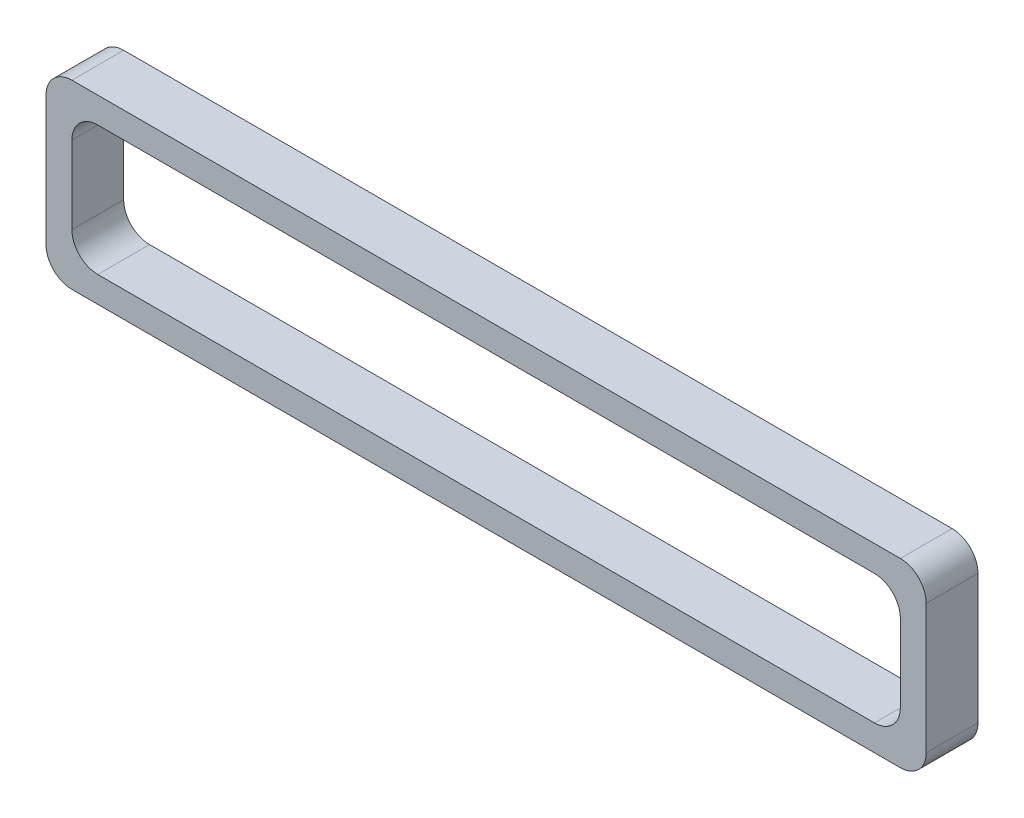
from build123d import *

# Parameters (mm, degrees)
BOSS_EXTRUDE1_DEPTH = 2


with BuildPart() as part:
    # Sketch1 → Boss-Extrude1 (new body)
    with BuildSketch(Plane.XY):
        with BuildLine():
            Line((-16, 3.5), (16, 3.5))
            ThreePointArc((16, 3.5), (16.707106781, 3.207106781), (17, 2.5))
            Line((17, 2.5), (17, -2.5))
            ThreePointArc((17, -2.5), (16.707106781, -3.207106781), (16, -3.5))
            Line((16, -3.5), (-16, -3.5))
            ThreePointArc((-16, -3.5), (-16.707106781, -3.207106781), (-17, -2.5))
            Line((-17, -2.5), (-17, 2.5))
            ThreePointArc((-17, 2.5), (-16.707106781, 3.207106781), (-16, 3.5))
        make_face()
        with BuildLine():
            Line((-15, 2.5), (15, 2.5))
            ThreePointArc((15, 2.5), (15.707106781, 2.207106781), (16, 1.5))
            Line((16, 1.5), (16, -1.5))
            ThreePointArc((16, -1.5), (15.707106781, -2.207106781), (15, -2.5))
            Line((15, -2.5), (-15, -2.5))
            ThreePointArc((-15, -2.5), (-15.707106781, -2.207106781), (-16, -1.5))
            Line((-16, -1.5), (-16, 1.5))
            ThreePointArc((-16, 1.5), (-15.707106781, 2.207106781), (-15, 2.5))
        make_face(mode=Mode.SUBTRACT)
    extrude(amount=BOSS_EXTRUDE1_DEPTH)


solid = part.part
